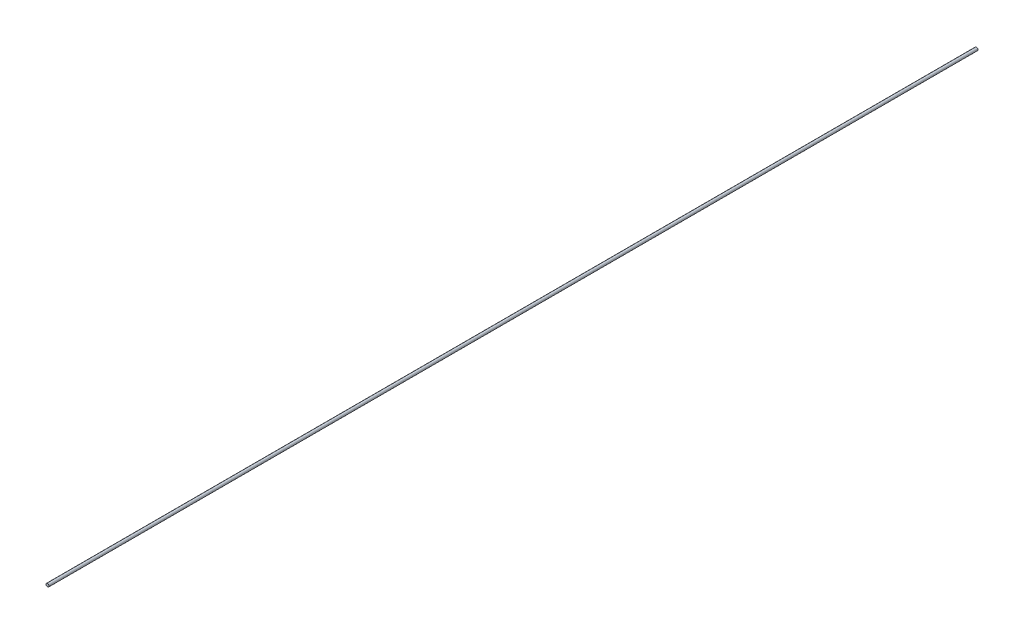
from build123d import *

# Parameters (mm, degrees)
SKETCH1_R           = 1
BOSS_EXTRUDE1_DEPTH = 610


with BuildPart() as part:
    # Sketch1 → Boss-Extrude1 (new body)
    with BuildSketch(Plane.XY):
        Circle(SKETCH1_R)
    extrude(amount=BOSS_EXTRUDE1_DEPTH)


solid = part.part
